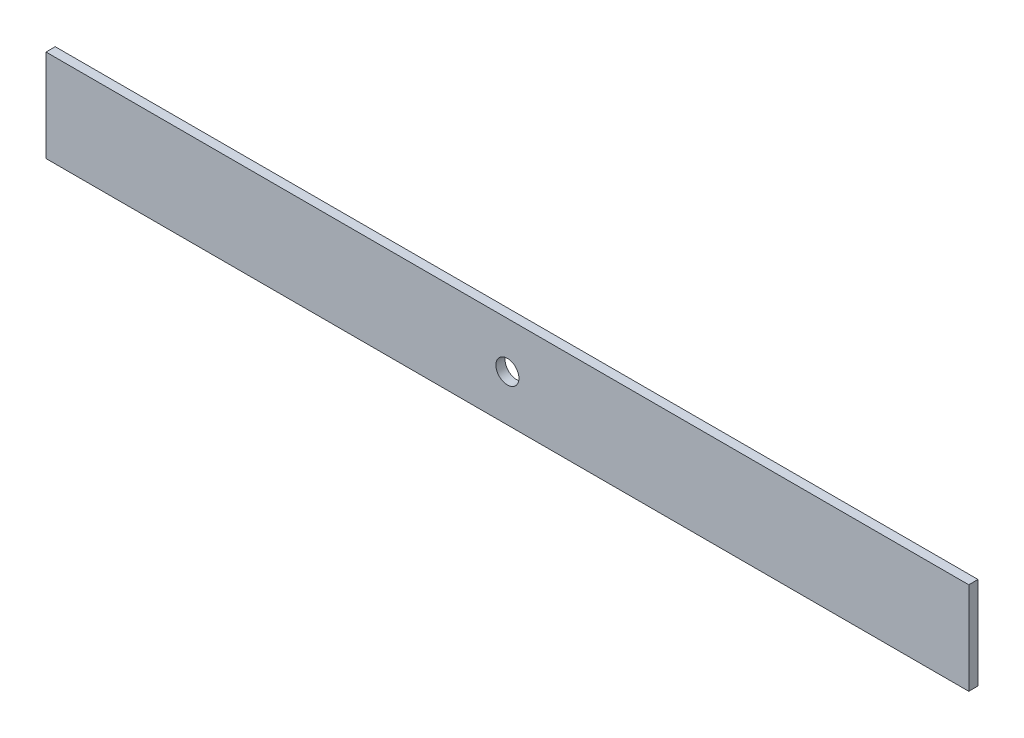
from build123d import *

# Parameters (mm, degrees)
SKETCH1_W           = 254
SKETCH1_H           = 25.4
SKETCH1_R           = 3.175
BOSS_EXTRUDE1_DEPTH = 2.54


with BuildPart() as part:
    # Sketch1 → Boss-Extrude1 (new body)
    with BuildSketch(Plane.XY):
        Rectangle(SKETCH1_W, SKETCH1_H)
        Circle(SKETCH1_R, mode=Mode.SUBTRACT)
    extrude(amount=BOSS_EXTRUDE1_DEPTH)


solid = part.part
